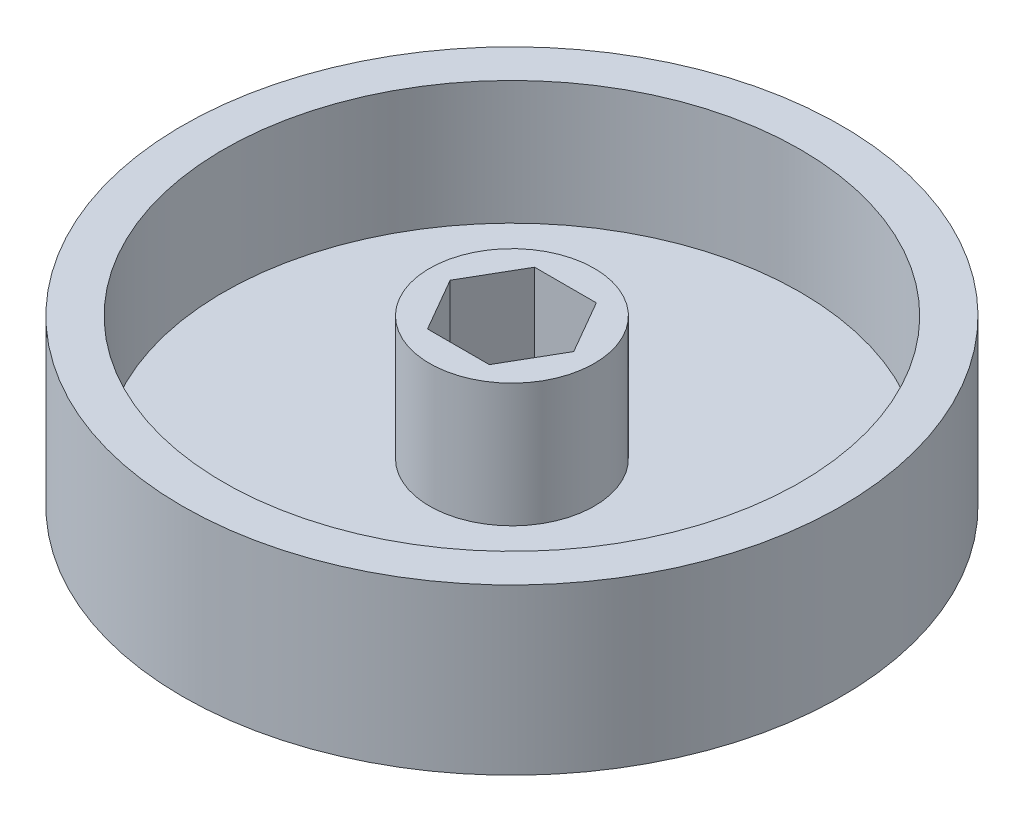
from build123d import *

# Parameters (mm, degrees)
SKETCH1_R           = 50.8
BOSS_EXTRUDE1_DEPTH = 6.35
SKETCH4_R           = 50.8
SKETCH4_R_2         = 44.45
BOSS_EXTRUDE2_DEPTH = 19.05
BOSS_EXTRUDE3_DEPTH = 19.05
CUT_EXTRUDE1_DEPTH  = 25.4


with BuildPart() as part:
    # Sketch1 → Boss-Extrude1 (new body)
    with BuildSketch(Plane(origin=(0, 0, 0), x_dir=(1, 0, 0), z_dir=(0, 1, 0))):
        Circle(SKETCH1_R)
    extrude(amount=BOSS_EXTRUDE1_DEPTH)

    # Sketch4 → Boss-Extrude2 (add)
    with BuildSketch(Plane(origin=(0, 6.35, 0), x_dir=(1, 0, 0), z_dir=(0, 1, 0))):
        Circle(SKETCH4_R)
        Circle(SKETCH4_R_2, mode=Mode.SUBTRACT)
    extrude(amount=BOSS_EXTRUDE2_DEPTH)

    # Sketch5 → Boss-Extrude3 (add)
    with BuildSketch(Plane(origin=(0, 6.35, 0), x_dir=(1, 0, 0), z_dir=(0, 1, 0))):
        with BuildLine():
            ThreePointArc((8.516460164, -9.421247597), (11.607089301, -5.154170929), (12.7, 0))
            ThreePointArc((12.7, 0), (-11.607089301, 5.154170929), (8.516460164, -9.421247597))
        make_face()
    extrude(amount=BOSS_EXTRUDE3_DEPTH)

    # Sketch6 → Cut-Extrude1 (cut)
    with BuildSketch(Plane(origin=(0, 25.4, 0), x_dir=(1, 0, 0), z_dir=(0, 1, 0))):
        Polygon((4.7625, -8.248891971), (9.525, 0), (4.7625, 8.248891971), (-4.7625, 8.248891971), (-9.525, 0), (-4.7625, -8.248891971), align=None)
    extrude(amount=-CUT_EXTRUDE1_DEPTH, mode=Mode.SUBTRACT)


solid = part.part
